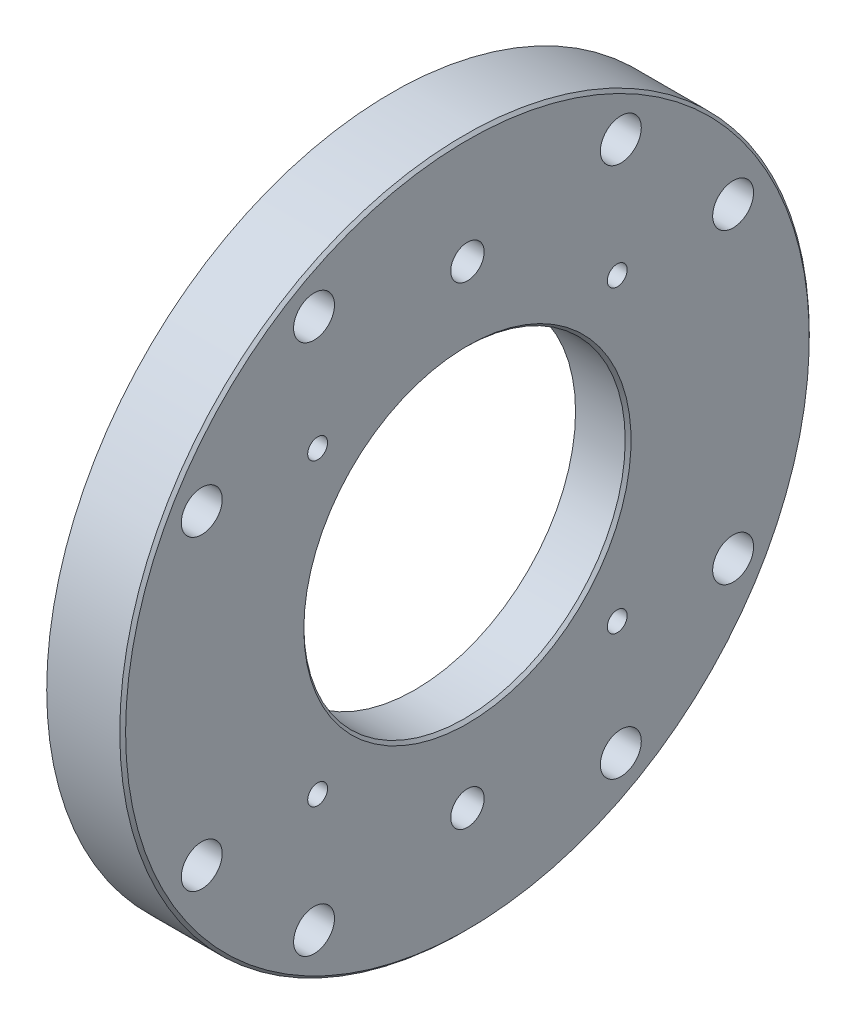
from build123d import *

# Parameters (mm, degrees)
CUT_EXTRUDE_1_DEPTH      = 169.890497068
CUT_EXTRUDE_1_DEPTH_BACK = 169.890497068
SKETCH_2_R               = 7
SKETCH_2_R_2             = 3.4
SKETCH_2_R_3             = 5.7226


with BuildPart() as part:
    # ｽｹｯﾁ1 → 回転1 (revolve)
    with BuildSketch(Plane.XY, mode=Mode.PRIVATE) as revolve_1_sk:
        Polygon((0, 115.5), (0.5, 115), (3, 115), (3, 88), (8, 88), (8, 55), (25, 55), (26, 56), (26, 117), (25, 118), (0, 118), align=None)
    revolve(revolve_1_sk.sketch.rotate(Axis((0, 0, 0), (1, 0, 0)), 90), axis=Axis((0, 0, 0), (1, 0, 0)))

    # ｽｹｯﾁ2 → ｶｯﾄ - 押し出し1 (cut, two sides: drawn at the far end of the back side and taken through both)
    with BuildSketch(Plane(origin=(0, 0, 0), x_dir=(0, 0, -1), z_dir=(1, 0, 0)).offset(-CUT_EXTRUDE_1_DEPTH_BACK)):
        with Locations((90.932667397, 52.5)):
            Circle(SKETCH_2_R)
        with Locations((52.5, 90.932667397)):
            Circle(SKETCH_2_R)
        with Locations((-52.5, 90.932667397)):
            Circle(SKETCH_2_R)
        with Locations((-90.932667397, 52.5)):
            Circle(SKETCH_2_R)
        with Locations((-90.932667397, -52.5)):
            Circle(SKETCH_2_R)
        with Locations((-52.5, -90.932667397)):
            Circle(SKETCH_2_R)
        with Locations((52.5, -90.932667397)):
            Circle(SKETCH_2_R)
        with Locations((90.932667397, -52.5)):
            Circle(SKETCH_2_R)
        with Locations((51.265241636, 51.265241636)):
            Circle(SKETCH_2_R_2)
        with Locations((-51.265241636, 51.265241636)):
            Circle(SKETCH_2_R_2)
        with Locations((-51.265241636, -51.265241636)):
            Circle(SKETCH_2_R_2)
        with Locations((51.265241636, -51.265241636)):
            Circle(SKETCH_2_R_2)
        with Locations((0, 81)):
            Circle(SKETCH_2_R_3)
        with Locations((0, -81)):
            Circle(SKETCH_2_R_3)
    extrude(amount=CUT_EXTRUDE_1_DEPTH + CUT_EXTRUDE_1_DEPTH_BACK, mode=Mode.SUBTRACT)


solid = part.part
